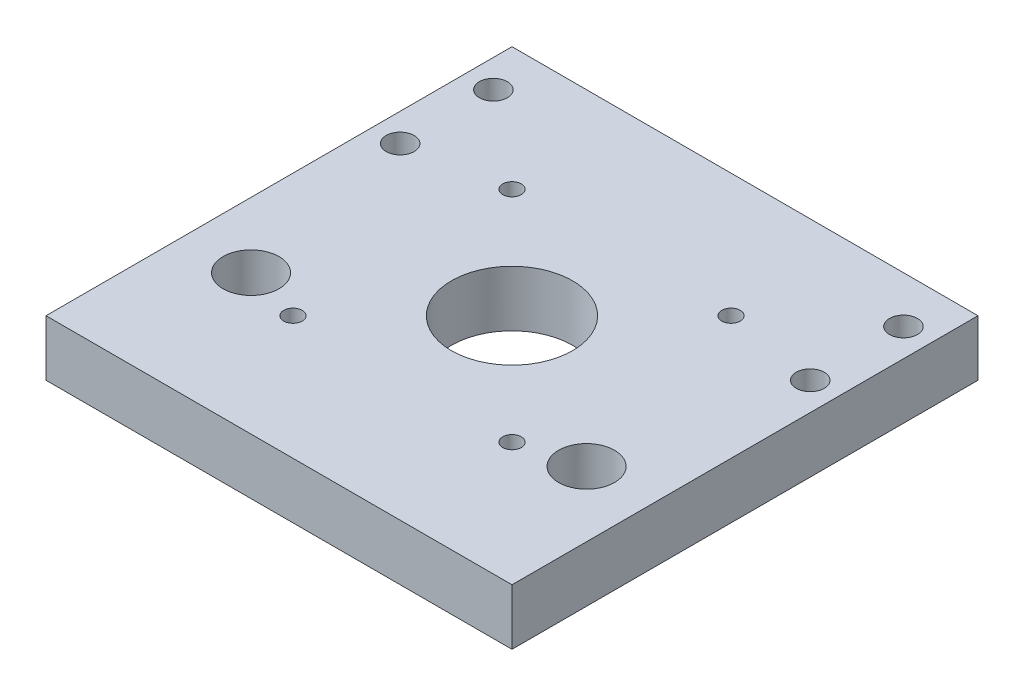
from build123d import *

# Parameters (mm, degrees)
SKETCH1_W           = 100
SKETCH1_H           = 100
BOSS_EXTRUDE1_DEPTH = 12
CUT_EXTRUDE1_REACH  = 88.856
SKETCH2_R           = 3
CUT_EXTRUDE2_REACH  = 88.856
SKETCH3_R           = 2
SKETCH3_R_2         = 13
CUT_EXTRUDE3_REACH  = 88.856
SKETCH4_R           = 6


with BuildPart() as part:
    # Sketch1 → Boss-Extrude1 (new body)
    with BuildSketch(Plane(origin=(0, 0, 0), x_dir=(1, 0, 0), z_dir=(0, 1, 0))):
        with Locations((0, -20)):
            Rectangle(SKETCH1_W, SKETCH1_H)
    extrude(amount=BOSS_EXTRUDE1_DEPTH)

    # Sketch2 → Cut-Extrude1 (cut, up to next)
    with BuildSketch(Plane(origin=(0, 12, 0), x_dir=(1, 0, 0), z_dir=(0, 1, 0)), mode=Mode.PRIVATE) as cut_extrude1_sk1:
        with Locations(Location((-44, 20, 0), (0, 0, 270))):
            Circle(SKETCH2_R)
    cut_extrude1_tool1 = extrude(cut_extrude1_sk1.sketch, amount=-CUT_EXTRUDE1_REACH, mode=Mode.PRIVATE) & part.part
    # Sketch2 → Cut-Extrude1 (cut, up to next)
    with BuildSketch(Plane(origin=(0, 12, 0), x_dir=(1, 0, 0), z_dir=(0, 1, 0)), mode=Mode.PRIVATE) as cut_extrude1_sk2:
        with Locations(Location((-44, 0, 0), (0, 0, 270))):
            Circle(SKETCH2_R)
    cut_extrude1_tool2 = extrude(cut_extrude1_sk2.sketch, amount=-CUT_EXTRUDE1_REACH, mode=Mode.PRIVATE) & part.part
    # Sketch2 → Cut-Extrude1 (cut, up to next)
    with BuildSketch(Plane(origin=(0, 12, 0), x_dir=(1, 0, 0), z_dir=(0, 1, 0)), mode=Mode.PRIVATE) as cut_extrude1_sk3:
        with Locations(Location((44, 20, 0), (0, 0, 270))):
            Circle(SKETCH2_R)
    cut_extrude1_tool3 = extrude(cut_extrude1_sk3.sketch, amount=-CUT_EXTRUDE1_REACH, mode=Mode.PRIVATE) & part.part
    # Sketch2 → Cut-Extrude1 (cut, up to next)
    with BuildSketch(Plane(origin=(0, 12, 0), x_dir=(1, 0, 0), z_dir=(0, 1, 0)), mode=Mode.PRIVATE) as cut_extrude1_sk4:
        with Locations(Location((44, 0, 0), (0, 0, 270))):
            Circle(SKETCH2_R)
    cut_extrude1_tool4 = extrude(cut_extrude1_sk4.sketch, amount=-CUT_EXTRUDE1_REACH, mode=Mode.PRIVATE) & part.part
    add(cut_extrude1_tool1.solids().sort_by_distance((-44, 12, -20))[0], mode=Mode.SUBTRACT)
    add(cut_extrude1_tool2.solids().sort_by_distance((-44, 12, 0))[0], mode=Mode.SUBTRACT)
    add(cut_extrude1_tool3.solids().sort_by_distance((44, 12, -20))[0], mode=Mode.SUBTRACT)
    add(cut_extrude1_tool4.solids().sort_by_distance((44, 12, 0))[0], mode=Mode.SUBTRACT)

    # Sketch3 → Cut-Extrude2 (cut, up to next)
    with BuildSketch(Plane(origin=(0, 12, 0), x_dir=(1, 0, 0), z_dir=(0, 1, 0)), mode=Mode.PRIVATE) as cut_extrude2_sk1:
        with Locations(Location((-23.5, -43.5, 0), (0, 0, 270))):
            Circle(SKETCH3_R)
    cut_extrude2_tool1 = extrude(cut_extrude2_sk1.sketch, amount=-CUT_EXTRUDE2_REACH, mode=Mode.PRIVATE) & part.part
    # Sketch3 → Cut-Extrude2 (cut, up to next)
    with BuildSketch(Plane(origin=(0, 12, 0), x_dir=(1, 0, 0), z_dir=(0, 1, 0)), mode=Mode.PRIVATE) as cut_extrude2_sk2:
        with Locations(Location((23.5, -43.5, 0), (0, 0, 270))):
            Circle(SKETCH3_R)
    cut_extrude2_tool2 = extrude(cut_extrude2_sk2.sketch, amount=-CUT_EXTRUDE2_REACH, mode=Mode.PRIVATE) & part.part
    # Sketch3 → Cut-Extrude2 (cut, up to next)
    with BuildSketch(Plane(origin=(0, 12, 0), x_dir=(1, 0, 0), z_dir=(0, 1, 0)), mode=Mode.PRIVATE) as cut_extrude2_sk3:
        with Locations(Location((23.5, 3.5, 0), (0, 0, 270))):
            Circle(SKETCH3_R)
    cut_extrude2_tool3 = extrude(cut_extrude2_sk3.sketch, amount=-CUT_EXTRUDE2_REACH, mode=Mode.PRIVATE) & part.part
    # Sketch3 → Cut-Extrude2 (cut, up to next)
    with BuildSketch(Plane(origin=(0, 12, 0), x_dir=(1, 0, 0), z_dir=(0, 1, 0)), mode=Mode.PRIVATE) as cut_extrude2_sk4:
        with Locations(Location((-23.5, 3.5, 0), (0, 0, 270))):
            Circle(SKETCH3_R)
    cut_extrude2_tool4 = extrude(cut_extrude2_sk4.sketch, amount=-CUT_EXTRUDE2_REACH, mode=Mode.PRIVATE) & part.part
    # Sketch3 → Cut-Extrude2 (cut, up to next)
    with BuildSketch(Plane(origin=(0, 12, 0), x_dir=(1, 0, 0), z_dir=(0, 1, 0)), mode=Mode.PRIVATE) as cut_extrude2_sk5:
        with Locations(Location((0, -20, 0), (0, 0, 270))):
            Circle(SKETCH3_R_2)
    cut_extrude2_tool5 = extrude(cut_extrude2_sk5.sketch, amount=-CUT_EXTRUDE2_REACH, mode=Mode.PRIVATE) & part.part
    add(cut_extrude2_tool1.solids().sort_by_distance((-23.5, 12, 43.5))[0], mode=Mode.SUBTRACT)
    add(cut_extrude2_tool2.solids().sort_by_distance((23.5, 12, 43.5))[0], mode=Mode.SUBTRACT)
    add(cut_extrude2_tool3.solids().sort_by_distance((23.5, 12, -3.5))[0], mode=Mode.SUBTRACT)
    add(cut_extrude2_tool4.solids().sort_by_distance((-23.5, 12, -3.5))[0], mode=Mode.SUBTRACT)
    add(cut_extrude2_tool5.solids().sort_by_distance((0, 12, 20))[0], mode=Mode.SUBTRACT)

    # Sketch4 → Cut-Extrude3 (cut, up to next)
    with BuildSketch(Plane(origin=(0, 12, 0), x_dir=(1, 0, 0), z_dir=(0, 1, 0)), mode=Mode.PRIVATE) as cut_extrude3_sk1:
        with Locations(Location((-36, -40, 0), (0, 0, 270))):
            Circle(SKETCH4_R)
    cut_extrude3_tool1 = extrude(cut_extrude3_sk1.sketch, amount=-CUT_EXTRUDE3_REACH, mode=Mode.PRIVATE) & part.part
    # Sketch4 → Cut-Extrude3 (cut, up to next)
    with BuildSketch(Plane(origin=(0, 12, 0), x_dir=(1, 0, 0), z_dir=(0, 1, 0)), mode=Mode.PRIVATE) as cut_extrude3_sk2:
        with Locations(Location((36, -40, 0), (0, 0, 270))):
            Circle(SKETCH4_R)
    cut_extrude3_tool2 = extrude(cut_extrude3_sk2.sketch, amount=-CUT_EXTRUDE3_REACH, mode=Mode.PRIVATE) & part.part
    add(cut_extrude3_tool1.solids().sort_by_distance((-36, 12, 40))[0], mode=Mode.SUBTRACT)
    add(cut_extrude3_tool2.solids().sort_by_distance((36, 12, 40))[0], mode=Mode.SUBTRACT)


solid = part.part
